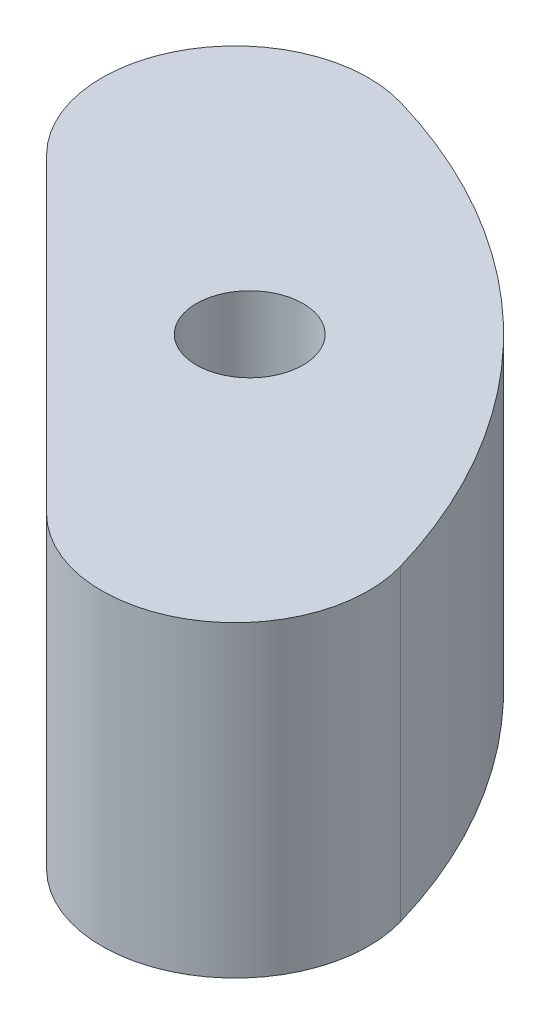
from build123d import *

# Parameters (mm, degrees)
SKETCH2_R           = 3.302
BOSS_EXTRUDE2_DEPTH = 9.525
SKETCH4_R           = 1.950000037
CUT_EXTRUDE2_DEPTH  = 5.800000084
FILLET1_R           = 8.255


with BuildPart() as part:
    # Sketch2 → Boss-Extrude2 (new, symmetric)
    with BuildSketch(Plane(origin=(0, 0, 0), x_dir=(1, 0, 0), z_dir=(0, 1, 0))):
        with BuildLine():
            Line((-11.353721197, 34.702387112), (34.702387112, -11.353721197))
            ThreePointArc((34.702387112, -11.353721197), (25.818236348, 25.818236348), (-11.353721197, 34.702387112))
        make_face()
        with Locations(Location((17.960512242, 17.960512242, 0), (0, 0, 90))):
            Circle(SKETCH2_R, mode=Mode.SUBTRACT)
    extrude(amount=BOSS_EXTRUDE2_DEPTH, both=True)

    # Sketch4 → Cut-Extrude2 (cut)
    with BuildSketch(Plane(origin=(11.674332957, 0, -11.674332957), x_dir=(0.7071067811865476, 0, 0.7071067811865475), z_dir=(-0.7071067811865475, 0, 0.7071067811865476))):
        with Locations((9.969999999, 6.249999946)):
            Circle(SKETCH4_R)
        with Locations((-9.969999999, 6.249999946)):
            Circle(SKETCH4_R)
        with Locations((-9.969999999, -6.249999946)):
            Circle(SKETCH4_R)
        with Locations((9.969999999, -6.249999946)):
            Circle(SKETCH4_R)
    extrude(amount=-CUT_EXTRUDE2_DEPTH, mode=Mode.SUBTRACT)

    # Fillet1
    fillet1_edges = [part.edges().sort_by_distance(p)[0] for p in [
        (34.702387112, 0, 11.353721197),
        (-11.353721197, 0, -34.702387112),
    ]]
    fillet(fillet1_edges, radius=FILLET1_R)


solid = part.part
